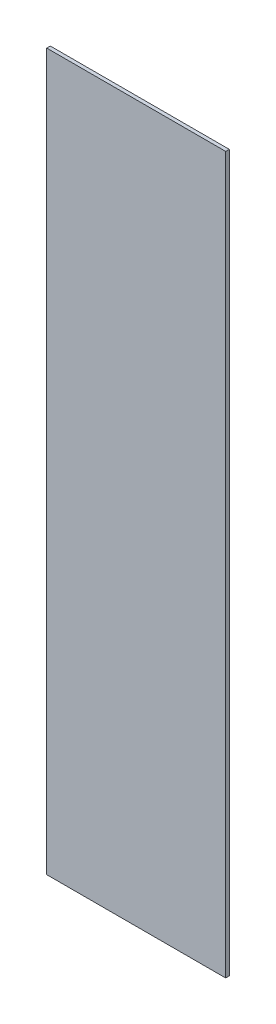
from build123d import *

# Parameters (mm, degrees)
BASESKETCH_W = 1270
BASESKETCH_H = 5080
BLOCK_DEPTH  = 25.4


with BuildPart() as part:
    # BaseSketch → BLOCK (new body)
    with BuildSketch(Plane.XY):
        Rectangle(BASESKETCH_W, BASESKETCH_H)
    extrude(amount=BLOCK_DEPTH)


solid = part.part
